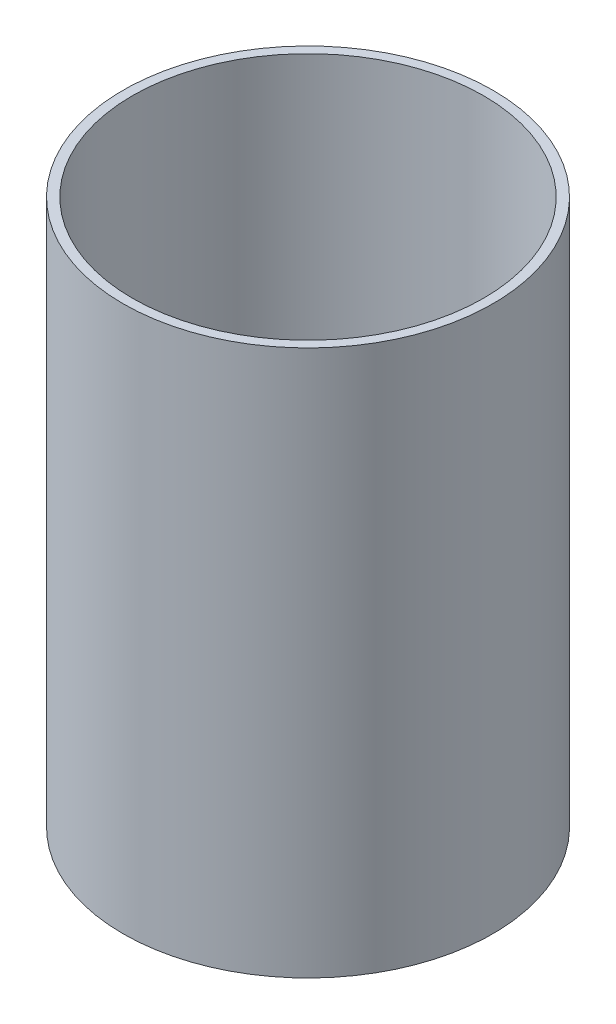
from build123d import *

# Parameters (mm, degrees)
SKETCH1_R           = 49.911
SKETCH1_R_2         = 47.371
BOSS_EXTRUDE1_DEPTH = 144.7292
BOSS_EXTRUDE2_START = 2.54
SKETCH2_R           = 49.911
BOSS_EXTRUDE2_DEPTH = 2.54


with BuildPart() as part:
    # Sketch1 → Boss-Extrude1 (new body)
    with BuildSketch(Plane(origin=(0, 0, 0), x_dir=(1, 0, 0), z_dir=(0, 1, 0))):
        with Locations(Location((0, 0, 0), (0, 0, 270))):
            Circle(SKETCH1_R)
        with Locations(Location((0, 0, 0), (0, 0, 270))):
            Circle(SKETCH1_R_2, mode=Mode.SUBTRACT)
    extrude(amount=BOSS_EXTRUDE1_DEPTH)

    # Sketch2 → Boss-Extrude2 (add)
    with BuildSketch(Plane.XZ.offset(BOSS_EXTRUDE2_START)):
        with Locations(Location((0, 0, 0), (0, 0, 270))):
            Circle(SKETCH2_R)
    extrude(amount=-BOSS_EXTRUDE2_DEPTH)


solid = part.part
